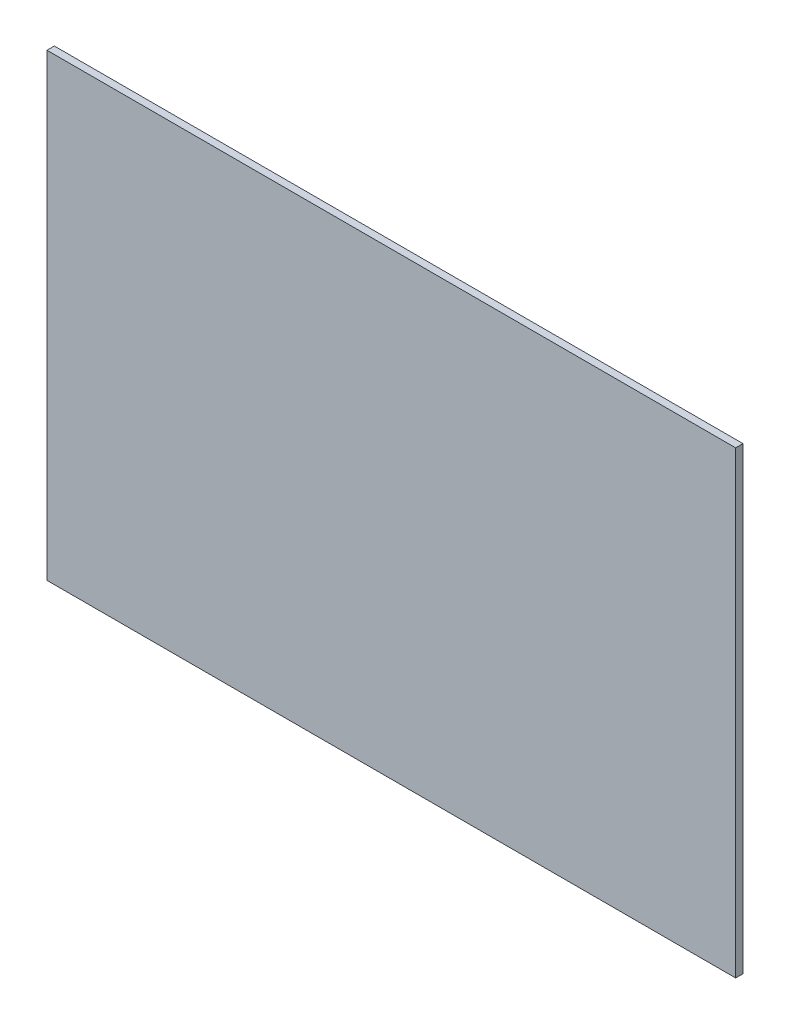
from build123d import *

# Parameters (mm, degrees)
SKETCH_1_W      = 150
SKETCH_1_H      = 100
EXTRUDE_1_DEPTH = 1.6


with BuildPart() as part:
    # ｽｹｯﾁ1 → ﾎﾞｽ - 押し出し1 (new body)
    with BuildSketch(Plane.XY):
        with Locations((1.105582562, 11.992857143)):
            Rectangle(SKETCH_1_W, SKETCH_1_H)
    extrude(amount=EXTRUDE_1_DEPTH)


solid = part.part
